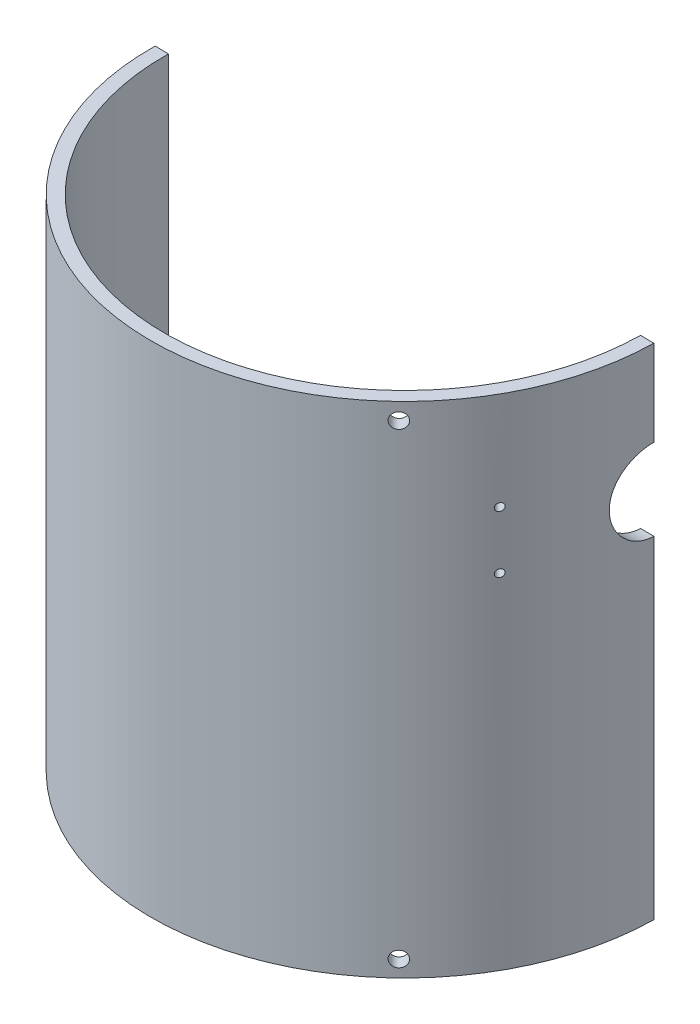
from build123d import *

# Parameters (mm, degrees)
BOSS_EXTRUDE1_DEPTH     = 130.8
SKETCH34_R              = 10.65
CUT_EXTRUDE2_DEPTH      = 157.940740259
SKETCH35_R              = 10.65
CUT_EXTRUDE3_DEPTH      = 157.940740428
CUT_EXTRUDE8_DEPTH      = 132.768470688
CUT_EXTRUDE8_DEPTH_BACK = 132.768470688
SKETCH40_R              = 2
CUT_EXTRUDE9_DEPTH      = 136.886547659
CUT_EXTRUDE9_DEPTH_BACK = 136.886547659
SKETCH41_R              = 2.000000001
SKETCH42_R              = 1
CUT_EXTRUDE10_DEPTH     = 159.175431949
SKETCH43_R              = 1
CUT_EXTRUDE11_DEPTH     = 158.012751408


with BuildPart() as part:
    # Sketch1 → Boss-Extrude1 (new body)
    with BuildSketch(Plane(origin=(0, 0, 0), x_dir=(0.999872775920664, 0, 0.01595092388251422), z_dir=(0, 1, 0))):
        with BuildLine():
            Line((70.372282363, 4.818066557), (66.856282363, 4.818066557))
            ThreePointArc((66.856282363, 4.818066557), (4.002282363, -58.035933443), (-58.851717637, 4.818066557))
            Line((-58.851717637, 4.818066557), (-62.367717637, 4.818066557))
            ThreePointArc((-62.367717637, 4.818066557), (4.002282363, -61.551933443), (70.372282363, 4.818066557))
        make_face()
    extrude(amount=BOSS_EXTRUDE1_DEPTH)

    # Sketch34 → Cut-Extrude2 (cut, through all)
    with BuildSketch(Plane(origin=(4.409550098, 18.583358198, -25.497377904), x_dir=(0.01595092388251443, 0, -0.9998727759206639), z_dir=(0.9998727759206639, 0, 0.01595092388251443))):
        with Locations((-20.746403865, 79.066641802)):
            Circle(SKETCH34_R)
    extrude(amount=CUT_EXTRUDE2_DEPTH, mode=Mode.SUBTRACT)

    # Sketch35 → Cut-Extrude3 (cut, through all)
    with BuildSketch(Plane(origin=(4.409550098, 18.583358198, -25.497377904), x_dir=(0.01595092388251443, 0, -0.9998727759206639), z_dir=(0.9998727759206639, 0, 0.01595092388251443))):
        with Locations((-20.746403865, 30.666641802)):
            Circle(SKETCH35_R)
    extrude(amount=-CUT_EXTRUDE3_DEPTH, mode=Mode.SUBTRACT)

    # Sketch40 → Cut-Extrude8 (cut, two sides: drawn at the far end of the back side and taken through both)
    with BuildSketch(Plane(origin=(3.677708785, 38.899932993, -5.167441514), x_dir=(-0.6958141043149662, 0, -0.7182219240850014), z_dir=(0.7182219240850014, 0, -0.6958141043149662)).offset(-CUT_EXTRUDE8_DEPTH_BACK)):
        with Locations(Location((-0.576184071, 87.550067007, 0), (0, 0, 180))):
            Circle(SKETCH40_R)
        with Locations(Location((-0.576184071, -34.599932993, 0), (0, 0, 180))):
            Circle(SKETCH40_R)
    extrude(amount=CUT_EXTRUDE8_DEPTH + CUT_EXTRUDE8_DEPTH_BACK, mode=Mode.SUBTRACT)

    # Sketch41 → Cut-Extrude9 (cut, two sides: drawn at the far end of the back side and taken through both)
    with BuildSketch(Plane(origin=(8.558168581, 38.899932993, -9.093398931), x_dir=(-0.7182219240850014, 0, 0.6958141043149662), z_dir=(-0.6958141043149662, 0, -0.7182219240850014)).offset(-CUT_EXTRUDE9_DEPTH_BACK)):
        with Locations((6.236989769, 87.550067007)):
            Circle(SKETCH41_R)
        with Locations((6.236989769, -34.599932997)):
            Circle(SKETCH41_R)
    extrude(amount=CUT_EXTRUDE9_DEPTH + CUT_EXTRUDE9_DEPTH_BACK, mode=Mode.SUBTRACT)

    # Sketch42 → Cut-Extrude10 (cut, through all)
    with BuildSketch(Plane(origin=(57.474877903, 38.899932993, 41.409432257), x_dir=(0.7182958266208218, 0, -0.6957378137338163), z_dir=(0.6957378137338163, 0, 0.7182958266208218))):
        with Locations((12.409477286, 66.250067007)):
            Circle(SKETCH42_R)
        with Locations((12.409477286, 51.250067007)):
            Circle(SKETCH42_R)
    extrude(amount=-CUT_EXTRUDE10_DEPTH, mode=Mode.SUBTRACT)

    # Sketch43 → Cut-Extrude11 (cut, through all)
    with BuildSketch(Plane(origin=(-46.82502092, 38.899932993, 43.748332437), x_dir=(0.6957378137338114, 0, 0.7182958266208266), z_dir=(-0.7182958266208266, 0, 0.6957378137338114))):
        with Locations((-18.211184322, 17.850067007)):
            Circle(SKETCH43_R)
        with Locations((-18.211184322, 2.850067007)):
            Circle(SKETCH43_R)
    extrude(amount=-CUT_EXTRUDE11_DEPTH, mode=Mode.SUBTRACT)


solid = part.part
